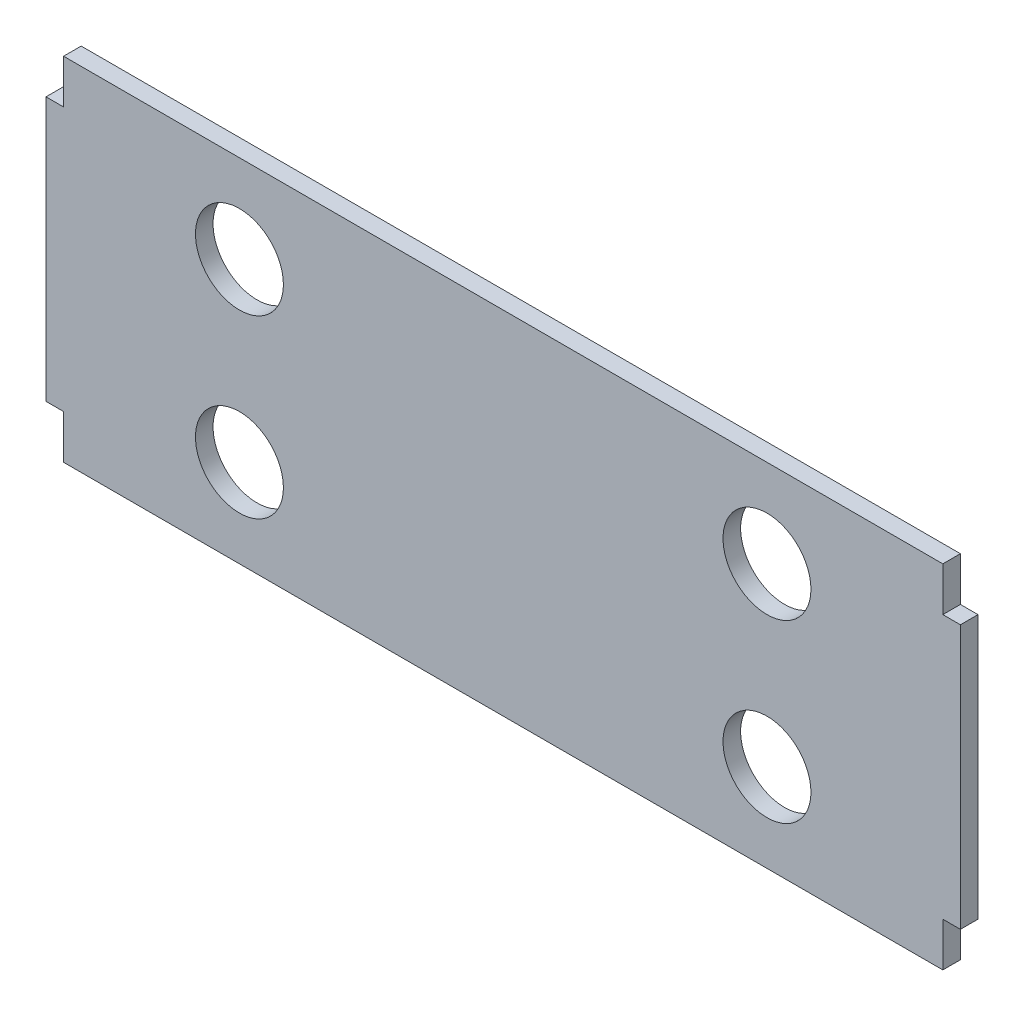
from build123d import *

# Parameters (mm, degrees)
SKETCH_1_W          = 2
SKETCH_1_H          = 30
SKETCH_1_W_2        = 100
SKETCH_1_H_2        = 40
EXTRUDE_1_DEPTH     = 2
SKETCH_2_R          = 5
CUT_EXTRUDE_1_DEPTH = 110.581020254


with BuildPart() as part:
    # 草图1 → 凸台-拉伸1 (new body)
    with BuildSketch(Plane.XY):
        with Locations((-1, 20)):
            Rectangle(SKETCH_1_W, SKETCH_1_H)
        with Locations((50, 20)):
            Rectangle(SKETCH_1_W_2, SKETCH_1_H_2)
        with Locations((101, 20)):
            Rectangle(SKETCH_1_W, SKETCH_1_H)
    extrude(amount=EXTRUDE_1_DEPTH)

    # 草图2 → 切除-拉伸1 (cut, through all)
    with BuildSketch(Plane.XY):
        with Locations((20, 30)):
            Circle(SKETCH_2_R)
        with Locations((80, 30)):
            Circle(SKETCH_2_R)
        with Locations((80, 10)):
            Circle(SKETCH_2_R)
        with Locations((20, 10)):
            Circle(SKETCH_2_R)
    extrude(amount=CUT_EXTRUDE_1_DEPTH, mode=Mode.SUBTRACT)


solid = part.part
